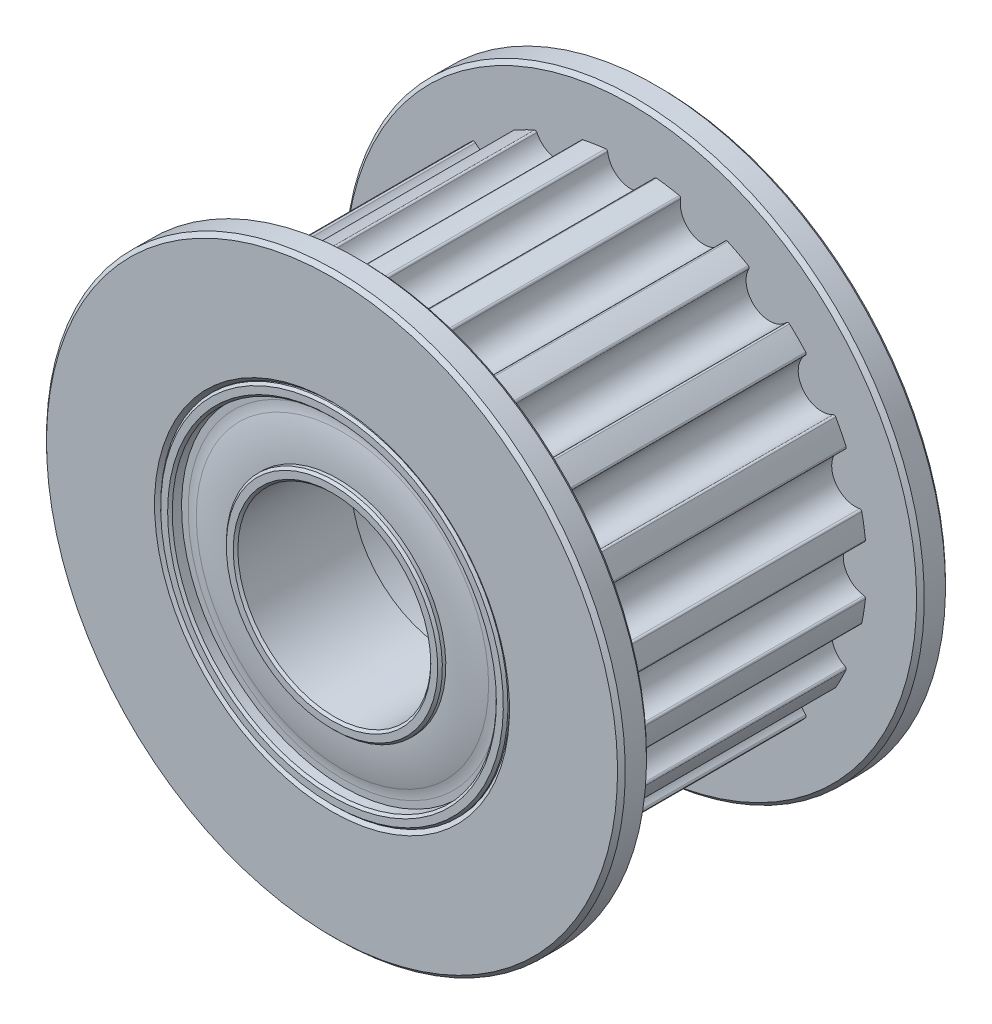
from build123d import *

# Parameters (mm, degrees)
CHAMFER2_SIZE            = 0.06
FILLET2_R                = 1
CHAMFER1_SIZE            = 0.1
CUT_EXTRUDE1_START       = -3.5
CUT_EXTRUDE1_DEPTH       = 7
FILLET1_R                = 0.05
CIRPATTERN3_COUNT        = 20
FILLET1_OF_CIRPATTERN3_R = 0.05


with BuildPart() as part:
    # Sketch2 → Revolve1 (revolve)
    with BuildSketch(Plane(origin=(0, 0, 0), x_dir=(0, 0, -1), z_dir=(1, 0, 0)), mode=Mode.PRIVATE) as revolve1_sk:
        with BuildLine():
            Line((4.25, 2.5), (1.25, 2.5))
            Line((1.25, 2.5), (1.25, 4.5))
            Line((1.25, 4.5), (4.25, 4.5))
            Line((4.25, 4.5), (4.25, 4.2))
            Line((4.25, 4.2), (3.95, 4.2))
            Line((3.95, 4.2), (3.95, 3.9))
            ThreePointArc((3.95, 3.9), (4.062327274, 3.355090083), (4.1, 2.8))
            Line((4.1, 2.8), (4.25, 2.8))
            Line((4.25, 2.8), (4.25, 2.5))
        make_face()
    revolve(revolve1_sk.sketch.rotate(Axis((0, 0, 4.25), (0, 0, -1)), 180), axis=Axis((0, 0, 4.25), (0, 0, -1)))

    # Chamfer2
    chamfer2_edges = [part.edges().sort_by_distance(p)[0] for p in [
        (0, 2.5, -4.25),
        (0, 2.8, -4.25),
        (0, 4.2, -4.25),
        (0, 4.5, -4.25),
    ]]
    chamfer(chamfer2_edges, length=CHAMFER2_SIZE)

    # Fillet2
    fillet2_edges = [part.edges().sort_by_distance(p)[0] for p in [
        (0, 3.9, -3.95),
    ]]
    fillet(fillet2_edges, radius=FILLET2_R)


with BuildPart() as body_2:
    # Mirror1: mirrored copy
    add(part.part.mirror(Plane.XY))


with BuildPart() as body_3:
    # Sketch3 → Revolve2 (revolve)
    with BuildSketch(Plane(origin=(0, 0, 0), x_dir=(0, 0, -1), z_dir=(1, 0, 0)), mode=Mode.PRIVATE) as revolve2_sk:
        Polygon((3.5, 7.5), (4.25, 7.5), (4.25, 4.5), (1.25, 4.5), (1.25, 3.5), (-1.25, 3.5), (-1.25, 4.5), (-4.25, 4.5), (-4.25, 7.5), (-3.5, 7.5), (-3.5, 6.11), (3.5, 6.11), align=None)
    revolve(revolve2_sk.sketch.rotate(Axis((0, 0, 4.25), (0, 0, -1)), 180), axis=Axis((0, 0, 4.25), (0, 0, -1)))

    # Chamfer1
    chamfer1_edges = [body_3.edges().sort_by_distance(p)[0] for p in [
        (0, 4.5, 4.25),
        (0, 4.5, -4.25),
        (0, 7.5, -4.25),
        (0, 7.5, -3.5),
        (0, 7.5, 3.5),
        (0, 7.5, 4.25),
    ]]
    chamfer(chamfer1_edges, length=CHAMFER1_SIZE)

    # Sketch4 → Cut-Extrude1 (cut)
    with BuildSketch(Plane.XY.offset(CUT_EXTRUDE1_START)):
        with BuildLine():
            Line((-0.611, 6.11), (0.611, 6.11))
            ThreePointArc((0.611, 6.11), (0, 5.499), (-0.611, 6.11))
        make_face()
    cut_extrude1 = extrude(amount=CUT_EXTRUDE1_DEPTH, mode=Mode.SUBTRACT)

    # Fillet1
    fillet1_edges = [body_3.edges().sort_by_distance(p)[0] for p in [
        (0.610235772, 6.07945, 0),
        (-0.610235772, 6.07945, 0),
    ]]
    fillet(fillet1_edges, radius=FILLET1_R)

    # CirPattern3: Cut-Extrude1 ×20 about axis
    cirpattern3_axis = Axis((0, 0, 0), (0, 0, 1))
    for i in range(1, CIRPATTERN3_COUNT):
        add(cut_extrude1.rotate(cirpattern3_axis, i * 360 / CIRPATTERN3_COUNT), mode=Mode.SUBTRACT)

    # Fillet1 of CirPattern3
    fillet1_of_cirpattern3_edges = [body_3.edges().sort_by_distance(p)[0] for p in [
        (-1.298284659, 5.970473762, 0),
        (-2.459022074, 5.593327314, 0),
        (-3.079719942, 5.277065954, 0),
        (-4.067102162, 4.559690779, 0),
        (-4.559690779, 4.067102162, 0),
        (-5.277065954, 3.079719942, 0),
        (-5.593327314, 2.459022074, 0),
        (-5.970473762, 1.298284659, 0),
        (-6.07945, 0.610235772, 0),
        (-6.07945, -0.610235772, 0),
        (-5.970473762, -1.298284659, 0),
        (-5.593327314, -2.459022074, 0),
        (-5.277065954, -3.079719942, 0),
        (-4.559690779, -4.067102162, 0),
        (-4.067102162, -4.559690779, 0),
        (-3.079719942, -5.277065954, 0),
        (-2.459022074, -5.593327314, 0),
        (-1.298284659, -5.970473762, 0),
        (-0.610235772, -6.07945, 0),
        (0.610235772, -6.07945, 0),
        (1.298284659, -5.970473762, 0),
        (2.459022074, -5.593327314, 0),
        (3.079719942, -5.277065954, 0),
        (4.067102162, -4.559690779, 0),
        (4.559690779, -4.067102162, 0),
        (5.277065954, -3.079719942, 0),
        (5.593327314, -2.459022074, 0),
        (5.970473762, -1.298284659, 0),
        (6.07945, -0.610235772, 0),
        (6.07945, 0.610235772, 0),
        (5.970473762, 1.298284659, 0),
        (5.593327314, 2.459022074, 0),
        (5.277065954, 3.079719942, 0),
        (4.559690779, 4.067102162, 0),
        (4.067102162, 4.559690779, 0),
        (3.079719942, 5.277065954, 0),
        (2.459022074, 5.593327314, 0),
        (1.298284659, 5.970473762, 0),
    ]]
    fillet(fillet1_of_cirpattern3_edges, radius=FILLET1_OF_CIRPATTERN3_R)


solid = Compound([part.part, body_2.part, body_3.part])
